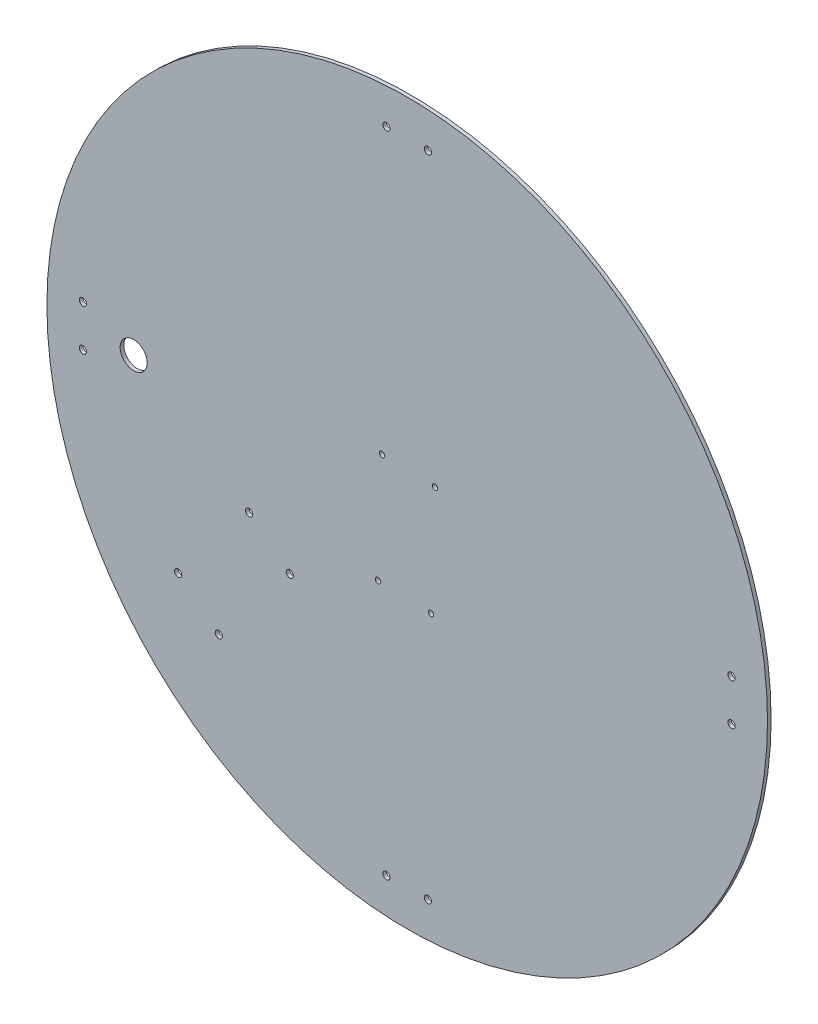
from build123d import *

# Parameters (mm, degrees)
SKETCH1_R           = 200
BOSS_EXTRUDE1_DEPTH = 2
SKETCH2_R           = 2
CUT_EXTRUDE1_DEPTH  = 13
CIRPATTERN1_COUNT   = 4
SKETCH5_R           = 7.5
CUT_EXTRUDE3_DEPTH  = 2
SKETCH7_R           = 2
CUT_EXTRUDE4_DEPTH  = 10
SKETCH8_R           = 1.5
CUT_EXTRUDE5_DEPTH  = 10


with BuildPart() as part:
    # Sketch1 → Boss-Extrude1 (new body)
    with BuildSketch(Plane.XY):
        Circle(SKETCH1_R)
    extrude(amount=BOSS_EXTRUDE1_DEPTH)

    # Sketch2 → Cut-Extrude1 (cut)
    with BuildSketch(Plane(origin=(0, 0, 0), x_dir=(-1, 0, 0), z_dir=(0, 0, -1))):
        with Locations((11.5, 180)):
            Circle(SKETCH2_R)
        with Locations(Location((-11.5, 180, 0), (0, 0, 180))):
            Circle(SKETCH2_R)
    cut_extrude1 = extrude(amount=-CUT_EXTRUDE1_DEPTH, mode=Mode.SUBTRACT)

    # CirPattern1: Cut-Extrude1 ×4 about axis
    cirpattern1_axis = Axis((0, 0, 0), (0, 0, 1))
    for i in range(1, CIRPATTERN1_COUNT):
        add(cut_extrude1.rotate(cirpattern1_axis, i * 360 / CIRPATTERN1_COUNT), mode=Mode.SUBTRACT)

    # Sketch5 → Cut-Extrude3 (cut)
    with BuildSketch(Plane(origin=(0, 0, 0), x_dir=(-1, 0, 0), z_dir=(0, 0, -1))):
        with Locations((151.829580255, 0)):
            Circle(SKETCH5_R)
    extrude(amount=-CUT_EXTRUDE3_DEPTH, mode=Mode.SUBTRACT)

    # Sketch7 → Cut-Extrude4 (cut)
    with BuildSketch(Plane(origin=(0, 0, 0), x_dir=(-1, 0, 0), z_dir=(0, 0, -1))):
        with Locations((127.130690154, -92.412874198)):
            Circle(SKETCH7_R)
        with Locations((104.565936539, -110.629127773)):
            Circle(SKETCH7_R)
        with Locations((65.181140017, -61.842574268)):
            Circle(SKETCH7_R)
        with Locations((87.745893632, -43.626320693)):
            Circle(SKETCH7_R)
    extrude(amount=-CUT_EXTRUDE4_DEPTH, mode=Mode.SUBTRACT)

    # Sketch8 → Cut-Extrude5 (cut)
    with BuildSketch(Plane(origin=(0, 0, 0), x_dir=(-1, 0, 0), z_dir=(0, 0, -1))):
        with Locations((-15.432875064, 20.159522992)):
            Circle(SKETCH8_R)
        with Locations((13.948214091, 21.213847451)):
            Circle(SKETCH8_R)
        with Locations((-13.216642017, -41.60072564)):
            Circle(SKETCH8_R)
        with Locations((16.164447138, -40.546401181)):
            Circle(SKETCH8_R)
    extrude(amount=-CUT_EXTRUDE5_DEPTH, mode=Mode.SUBTRACT)


solid = part.part
